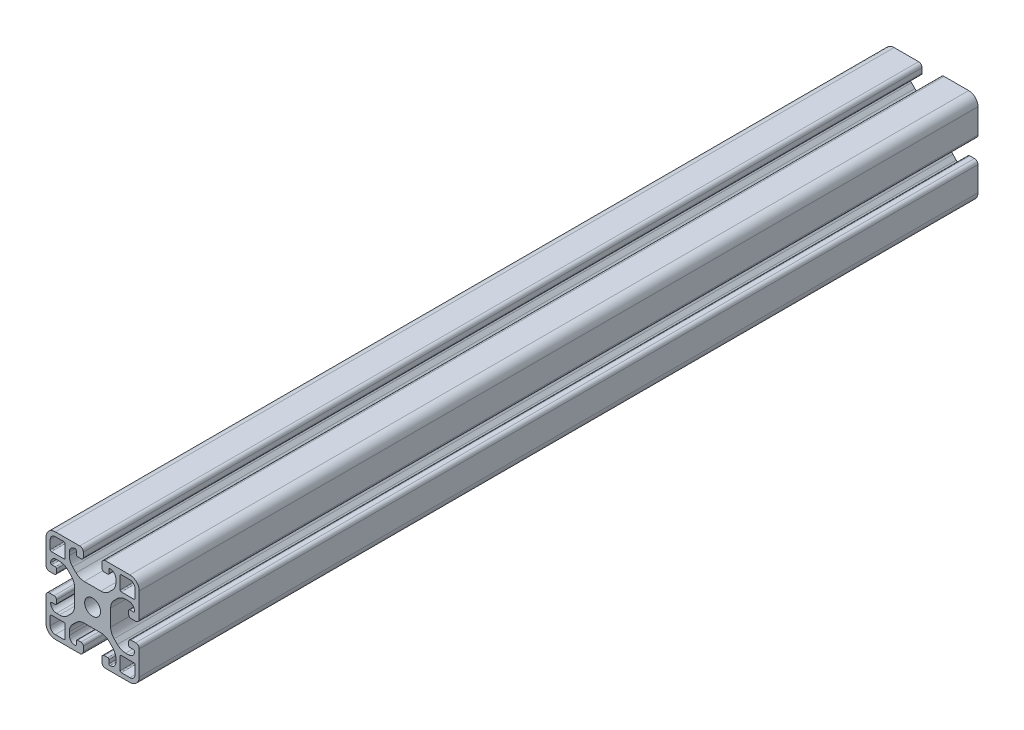
from build123d import *

# Parameters (mm, degrees)
ESQUISSE1_R        = 3.4
BOSS_EXTRU_1_DEPTH = 360


with BuildPart() as part:
    # Esquisse1 → Boss.-Extru.1 (new body)
    with BuildSketch(Plane(origin=(0, 0, -30), x_dir=(-1, 0, 0), z_dir=(0, 0, -1))):
        with BuildLine():
            Line((-4.5, 15), (-4.5, 13.5))
            ThreePointArc((-4.5, 13.5), (-4.353553391, 13.146446609), (-4, 13))
            Line((-4, 13), (-2.5, 13))
            ThreePointArc((-2.5, 13), (-2.146446609, 12.853553391), (-2, 12.5))
            ThreePointArc((-2, 12.5), (-2.732233047, 10.732233047), (-4.5, 10))
            Line((-4.5, 10), (-5.807611845, 10))
            ThreePointArc((-5.807611845, 10), (-7.721029006, 10.380602337), (-9.343145751, 11.464466094))
            Line((-9.343145751, 11.464466094), (-10.785533906, 12.906854249))
            ThreePointArc((-10.785533906, 12.906854249), (-11.869397663, 14.528970994), (-12.25, 16.442388155))
            Line((-12.25, 16.442388155), (-12.25, 23.557611845))
            ThreePointArc((-12.25, 23.557611845), (-11.869397663, 25.471029006), (-10.785533906, 27.093145751))
            Line((-10.785533906, 27.093145751), (-9.343145751, 28.535533906))
            ThreePointArc((-9.343145751, 28.535533906), (-7.721029006, 29.619397663), (-5.807611845, 30))
            Line((-5.807611845, 30), (-4.5, 30))
            ThreePointArc((-4.5, 30), (-2.732233047, 29.267766953), (-2, 27.5))
            ThreePointArc((-2, 27.5), (-2.146446609, 27.146446609), (-2.5, 27))
            Line((-2.5, 27), (-4, 27))
            ThreePointArc((-4, 27), (-4.353553391, 26.853553391), (-4.5, 26.5))
            Line((-4.5, 26.5), (-4.5, 25))
            ThreePointArc((-4.5, 25), (-4.207106781, 24.292893219), (-3.5, 24))
            Line((-3.5, 24), (-1.5, 24))
            ThreePointArc((-1.5, 24), (-0.439339828, 24.439339828), (0, 25.5))
            Line((0, 25.5), (0, 36))
            ThreePointArc((0, 36), (-1.171572875, 38.828427125), (-4, 40))
            Line((-4, 40), (-14.5, 40))
            ThreePointArc((-14.5, 40), (-15.560660172, 39.560660172), (-16, 38.5))
            Line((-16, 38.5), (-16, 36.5))
            ThreePointArc((-16, 36.5), (-15.707106781, 35.792893219), (-15, 35.5))
            Line((-15, 35.5), (-13.5, 35.5))
            ThreePointArc((-13.5, 35.5), (-13.146446609, 35.646446609), (-13, 36))
            Line((-13, 36), (-13, 37.5))
            ThreePointArc((-13, 37.5), (-12.853553391, 37.853553391), (-12.5, 38))
            ThreePointArc((-12.5, 38), (-10.732233047, 37.267766953), (-10, 35.5))
            Line((-10, 35.5), (-10, 34.192388155))
            ThreePointArc((-10, 34.192388155), (-10.380602337, 32.278970994), (-11.464466094, 30.656854249))
            Line((-11.464466094, 30.656854249), (-12.906854249, 29.214466094))
            ThreePointArc((-12.906854249, 29.214466094), (-14.528970994, 28.130602337), (-16.442388155, 27.75))
            Line((-16.442388155, 27.75), (-23.557611845, 27.75))
            ThreePointArc((-23.557611845, 27.75), (-25.471029006, 28.130602337), (-27.093145751, 29.214466094))
            Line((-27.093145751, 29.214466094), (-28.535533906, 30.656854249))
            ThreePointArc((-28.535533906, 30.656854249), (-29.619397663, 32.278970994), (-30, 34.192388155))
            Line((-30, 34.192388155), (-30, 35.5))
            ThreePointArc((-30, 35.5), (-29.267766953, 37.267766953), (-27.5, 38))
            ThreePointArc((-27.5, 38), (-27.146446609, 37.853553391), (-27, 37.5))
            Line((-27, 37.5), (-27, 36))
            ThreePointArc((-27, 36), (-26.853553391, 35.646446609), (-26.5, 35.5))
            Line((-26.5, 35.5), (-25, 35.5))
            ThreePointArc((-25, 35.5), (-24.292893219, 35.792893219), (-24, 36.5))
            Line((-24, 36.5), (-24, 38.5))
            ThreePointArc((-24, 38.5), (-24.439339828, 39.560660172), (-25.5, 40))
            Line((-25.5, 40), (-36, 40))
            ThreePointArc((-36, 40), (-38.828427125, 38.828427125), (-40, 36))
            Line((-40, 36), (-40, 25.5))
            ThreePointArc((-40, 25.5), (-39.560660172, 24.439339828), (-38.5, 24))
            Line((-38.5, 24), (-36.5, 24))
            ThreePointArc((-36.5, 24), (-35.792893219, 24.292893219), (-35.5, 25))
            Line((-35.5, 25), (-35.5, 26.5))
            ThreePointArc((-35.5, 26.5), (-35.646446609, 26.853553391), (-36, 27))
            Line((-36, 27), (-37.5, 27))
            ThreePointArc((-37.5, 27), (-37.853553391, 27.146446609), (-38, 27.5))
            ThreePointArc((-38, 27.5), (-37.267766953, 29.267766953), (-35.5, 30))
            Line((-35.5, 30), (-34.192388155, 30))
            ThreePointArc((-34.192388155, 30), (-32.278970994, 29.619397663), (-30.656854249, 28.535533906))
            Line((-30.656854249, 28.535533906), (-29.214466094, 27.093145751))
            ThreePointArc((-29.214466094, 27.093145751), (-28.130602337, 25.471029006), (-27.75, 23.557611845))
            Line((-27.75, 23.557611845), (-27.75, 16.442388155))
            ThreePointArc((-27.75, 16.442388155), (-28.130602337, 14.528970994), (-29.214466094, 12.906854249))
            Line((-29.214466094, 12.906854249), (-30.656854249, 11.464466094))
            ThreePointArc((-30.656854249, 11.464466094), (-32.278970994, 10.380602337), (-34.192388155, 10))
            Line((-34.192388155, 10), (-35.5, 10))
            ThreePointArc((-35.5, 10), (-37.267766953, 10.732233047), (-38, 12.5))
            ThreePointArc((-38, 12.5), (-37.853553391, 12.853553391), (-37.5, 13))
            Line((-37.5, 13), (-36, 13))
            ThreePointArc((-36, 13), (-35.646446609, 13.146446609), (-35.5, 13.5))
            Line((-35.5, 13.5), (-35.5, 15))
            ThreePointArc((-35.5, 15), (-35.792893219, 15.707106781), (-36.5, 16))
            Line((-36.5, 16), (-38.5, 16))
            ThreePointArc((-38.5, 16), (-39.560660172, 15.560660172), (-40, 14.5))
            Line((-40, 14.5), (-40, 4))
            ThreePointArc((-40, 4), (-38.828427125, 1.171572875), (-36, 0))
            Line((-36, 0), (-25.5, 0))
            ThreePointArc((-25.5, 0), (-24.439339828, 0.439339828), (-24, 1.5))
            Line((-24, 1.5), (-24, 3.5))
            ThreePointArc((-24, 3.5), (-24.292893219, 4.207106781), (-25, 4.5))
            Line((-25, 4.5), (-26.5, 4.5))
            ThreePointArc((-26.5, 4.5), (-26.853553391, 4.353553391), (-27, 4))
            Line((-27, 4), (-27, 2.5))
            ThreePointArc((-27, 2.5), (-27.146446609, 2.146446609), (-27.5, 2))
            ThreePointArc((-27.5, 2), (-29.267766953, 2.732233047), (-30, 4.5))
            Line((-30, 4.5), (-30, 5.807611845))
            ThreePointArc((-30, 5.807611845), (-29.619397663, 7.721029006), (-28.535533906, 9.343145751))
            Line((-28.535533906, 9.343145751), (-27.093145751, 10.785533906))
            ThreePointArc((-27.093145751, 10.785533906), (-25.471029006, 11.869397663), (-23.557611845, 12.25))
            Line((-23.557611845, 12.25), (-16.442388155, 12.25))
            ThreePointArc((-16.442388155, 12.25), (-14.528970994, 11.869397663), (-12.906854249, 10.785533906))
            Line((-12.906854249, 10.785533906), (-11.464466094, 9.343145751))
            ThreePointArc((-11.464466094, 9.343145751), (-10.380602337, 7.721029006), (-10, 5.807611845))
            Line((-10, 5.807611845), (-10, 4.5))
            ThreePointArc((-10, 4.5), (-10.732233047, 2.732233047), (-12.5, 2))
            ThreePointArc((-12.5, 2), (-12.853553391, 2.146446609), (-13, 2.5))
            Line((-13, 2.5), (-13, 4))
            ThreePointArc((-13, 4), (-13.146446609, 4.353553391), (-13.5, 4.5))
            Line((-13.5, 4.5), (-15, 4.5))
            ThreePointArc((-15, 4.5), (-15.707106781, 4.207106781), (-16, 3.5))
            Line((-16, 3.5), (-16, 1.5))
            ThreePointArc((-16, 1.5), (-15.560660172, 0.439339828), (-14.5, 0))
            Line((-14.5, 0), (-4, 0))
            ThreePointArc((-4, 0), (-1.171572875, 1.171572875), (0, 4))
            Line((0, 4), (0, 14.5))
            ThreePointArc((0, 14.5), (-0.439339828, 15.560660172), (-1.5, 16))
            Line((-1.5, 16), (-3.5, 16))
            ThreePointArc((-3.5, 16), (-4.207106781, 15.707106781), (-4.5, 15))
        make_face()
        with Locations((-20, 20)):
            Circle(ESQUISSE1_R, mode=Mode.SUBTRACT)
        with BuildLine():
            Line((-4, 1.8), (-7.7, 1.8))
            ThreePointArc((-7.7, 1.8), (-8.053553391, 1.946446609), (-8.2, 2.3))
            Line((-8.2, 2.3), (-8.2, 7.7))
            ThreePointArc((-8.2, 7.7), (-8.053553391, 8.053553391), (-7.7, 8.2))
            Line((-7.7, 8.2), (-2.3, 8.2))
            ThreePointArc((-2.3, 8.2), (-1.946446609, 8.053553391), (-1.8, 7.7))
            Line((-1.8, 7.7), (-1.8, 4))
            ThreePointArc((-1.8, 4), (-2.444365081, 2.444365081), (-4, 1.8))
        make_face(mode=Mode.SUBTRACT)
        with BuildLine():
            Line((-38.2, 4), (-38.2, 7.7))
            ThreePointArc((-38.2, 7.7), (-38.053553391, 8.053553391), (-37.7, 8.2))
            Line((-37.7, 8.2), (-32.3, 8.2))
            ThreePointArc((-32.3, 8.2), (-31.946446609, 8.053553391), (-31.8, 7.7))
            Line((-31.8, 7.7), (-31.8, 2.3))
            ThreePointArc((-31.8, 2.3), (-31.946446609, 1.946446609), (-32.3, 1.8))
            Line((-32.3, 1.8), (-36, 1.8))
            ThreePointArc((-36, 1.8), (-37.555634919, 2.444365081), (-38.2, 4))
        make_face(mode=Mode.SUBTRACT)
        with BuildLine():
            Line((-36, 38.2), (-32.3, 38.2))
            ThreePointArc((-32.3, 38.2), (-31.946446609, 38.053553391), (-31.8, 37.7))
            Line((-31.8, 37.7), (-31.8, 32.3))
            ThreePointArc((-31.8, 32.3), (-31.946446609, 31.946446609), (-32.3, 31.8))
            Line((-32.3, 31.8), (-37.7, 31.8))
            ThreePointArc((-37.7, 31.8), (-38.053553391, 31.946446609), (-38.2, 32.3))
            Line((-38.2, 32.3), (-38.2, 36))
            ThreePointArc((-38.2, 36), (-37.555634919, 37.555634919), (-36, 38.2))
        make_face(mode=Mode.SUBTRACT)
        with BuildLine():
            Line((-1.8, 36), (-1.8, 32.3))
            ThreePointArc((-1.8, 32.3), (-1.946446609, 31.946446609), (-2.3, 31.8))
            Line((-2.3, 31.8), (-7.7, 31.8))
            ThreePointArc((-7.7, 31.8), (-8.053553391, 31.946446609), (-8.2, 32.3))
            Line((-8.2, 32.3), (-8.2, 37.7))
            ThreePointArc((-8.2, 37.7), (-8.053553391, 38.053553391), (-7.7, 38.2))
            Line((-7.7, 38.2), (-4, 38.2))
            ThreePointArc((-4, 38.2), (-2.444365081, 37.555634919), (-1.8, 36))
        make_face(mode=Mode.SUBTRACT)
    extrude(amount=-BOSS_EXTRU_1_DEPTH)


solid = part.part
